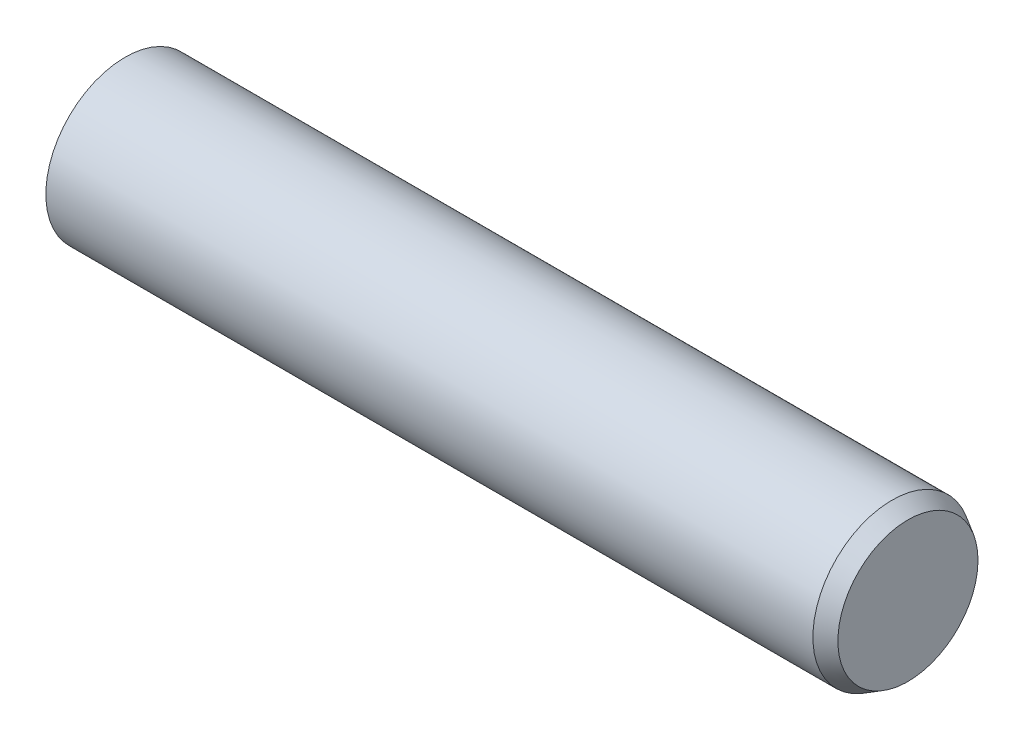
from build123d import *
from OCP.BRepFilletAPI import BRepFilletAPI_MakeChamfer

# Parameters (mm, degrees)
SKETCH1_R           = 10
BOSS_EXTRUDE1_DEPTH = 50
CHAMFER1_SIZE       = 2
CHAMFER1_SIZE2      = 1.154700538


with BuildPart() as part:
    # Sketch1 → Boss-Extrude1 (new, symmetric)
    with BuildSketch(Plane(origin=(0, 0, 0), x_dir=(0, 0, -1), z_dir=(1, 0, 0))):
        Circle(SKETCH1_R)
    extrude(amount=BOSS_EXTRUDE1_DEPTH, both=True)

    # Chamfer1: one chamfer whose edges measure the first distance from different faces: ONE call of the kernel's chamfer builder (chamfer() names one face for all edges)
    chamfer1_edges_1 = [part.edges().sort_by_distance(p)[0] for p in [
        (-50, 0, 10),
    ]]
    chamfer1_side_1 = [part.faces().sort_by_distance(p)[0] for p in [
        (-50, 0, 0),
    ]]
    chamfer1_edges_2 = [part.edges().sort_by_distance(p)[0] for p in [
        (50, 0, 10),
    ]]
    chamfer1_side_2 = [part.faces().sort_by_distance(p)[0] for p in [
        (0, 0, 10),
    ]]
    chamfer1 = BRepFilletAPI_MakeChamfer(part.part.solid().wrapped)
    for e in chamfer1_edges_1:
        chamfer1.Add(CHAMFER1_SIZE, CHAMFER1_SIZE2, e.wrapped, chamfer1_side_1[0].wrapped)  # the first distance lies on this face
    for e in chamfer1_edges_2:
        chamfer1.Add(CHAMFER1_SIZE, CHAMFER1_SIZE2, e.wrapped, chamfer1_side_2[0].wrapped)  # the first distance lies on this face
    add(Compound.cast(chamfer1.Shape()), mode=Mode.REPLACE)


solid = part.part
